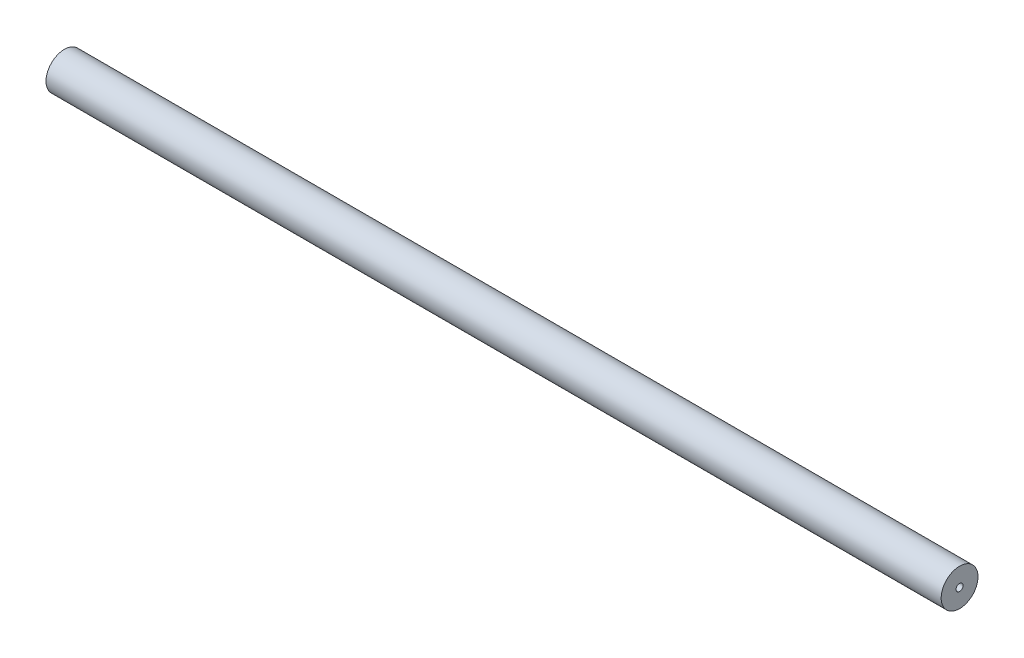
from build123d import *

# Parameters (mm, degrees)
SKETCH2_W = 600
SKETCH2_H = 10


with BuildPart() as part:
    # Sketch2 → Revolve-Thin1 (revolve)
    with BuildSketch(Plane.XY, mode=Mode.PRIVATE) as revolve_thin1_sk:
        with Locations((0, 7.35)):
            Rectangle(SKETCH2_W, SKETCH2_H)
    revolve(revolve_thin1_sk.sketch.rotate(Axis((-69.117222471, 0, 0), (1, 0, 0)), 180), axis=Axis((-69.117222471, 0, 0), (1, 0, 0)))


solid = part.part
